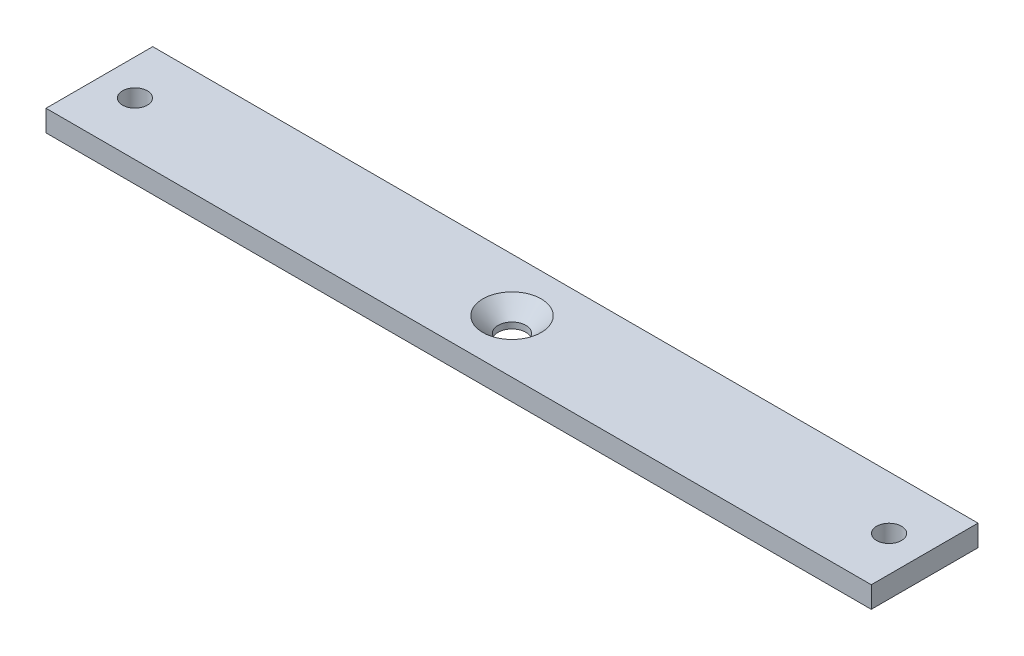
from build123d import *

# Parameters (mm, degrees)
EXTRUDE_1_DEPTH      = 1.5
EXTRUDE_1_DEPTH_BACK = 1.5
SKETCH_1_W           = 116
SKETCH_1_H           = 15
SKETCH_1_R           = 1.75


with BuildPart() as part:
    # Эскиз1 → Бобышка-Вытянуть1 (new, two sides: drawn at the far end of the back side and taken through both)
    with BuildSketch(Plane(origin=(0, 0, 0), x_dir=(1, 0, 0), z_dir=(0, 1, 0)).offset(-EXTRUDE_1_DEPTH_BACK)):
        Rectangle(SKETCH_1_W, SKETCH_1_H)
        with Locations((-53, 0)):
            Circle(SKETCH_1_R, mode=Mode.SUBTRACT)
        with BuildLine():
            ThreePointArc((1.75, 0), (0, -1.75), (-1.75, 0))
            ThreePointArc((-1.75, 0), (0, 1.75), (1.75, 0))
        make_face(mode=Mode.SUBTRACT)
        with BuildLine():
            ThreePointArc((54.75, 0), (53, -1.75), (51.25, 0))
            ThreePointArc((51.25, 0), (53, 1.75), (54.75, 0))
        make_face(mode=Mode.SUBTRACT)
    extrude(amount=EXTRUDE_1_DEPTH + EXTRUDE_1_DEPTH_BACK)

    # Эскиз2 → Зенковка для  винта с плоской головкой M3.51 (revolve, cut)
    with BuildSketch(Plane(origin=(0, 1.5, 0), x_dir=(0, 0, 1), z_dir=(1, 0, 0))):
        Polygon((0, 0), (0, 3), (1.95, 3), (1.95, 2.15), (4.1, 0), align=None)
    revolve(axis=Axis((0, 7.85, 0), (0, -1, 0)), mode=Mode.SUBTRACT)


solid = part.part
